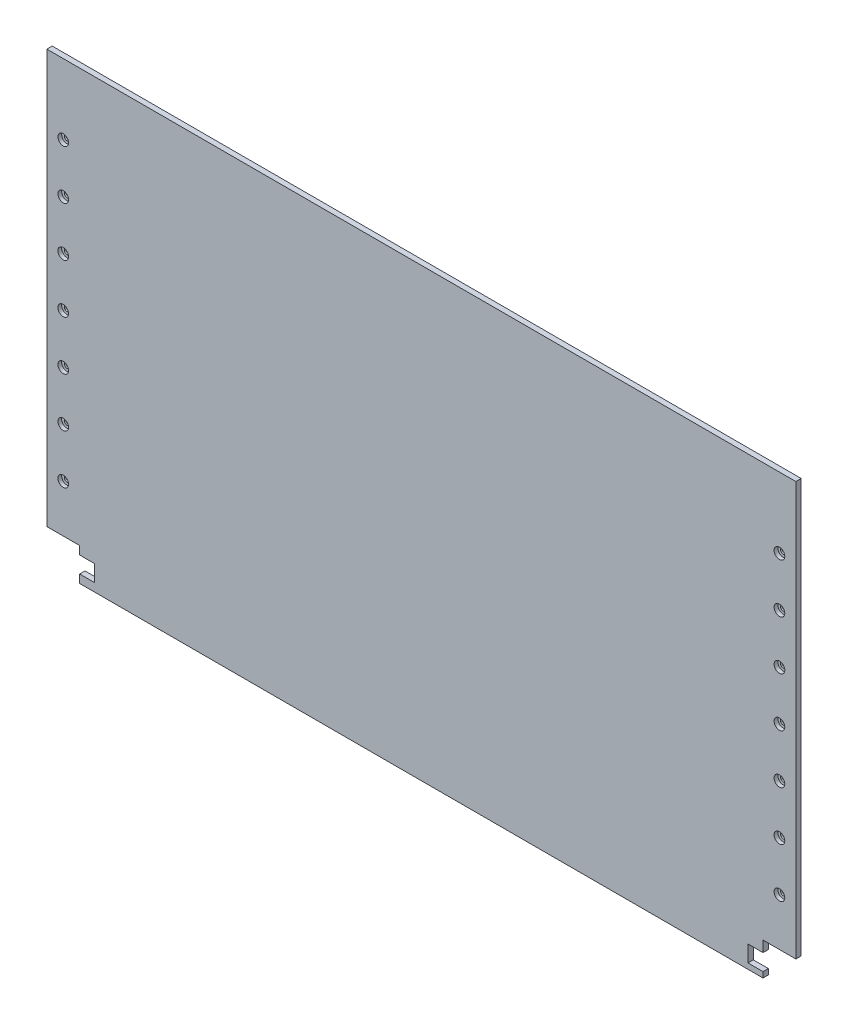
from build123d import *

# Parameters (mm, degrees)
BOSS_EXTRU_1_DEPTH         = 6.5
D_GAGEMENT_M61_D           = 6.6
R_P_TITION_LIN_AIRE1_COUNT = 7
R_P_TITION_LIN_AIRE1_PITCH = 60


with BuildPart() as part:
    # Esquisse1 → Boss.-Extru.1 (new body)
    with BuildSketch(Plane.XY):
        Polygon((416, -265.000000009), (416, -251.75), (456, -251.75), (456, 251.75), (-456, 251.75), (-456, -251.75), (-416, -251.75), (-416, -261.75000001), (-397.670089581, -261.75000001), (-397.670089581, -281.75000001), (-416, -281.75000001), (-416, -291.75), (416, -291.75), (416, -288.5), (416, -285.000000009), (397.67, -285.000000009), (397.67, -265.000000009), align=None)
    extrude(amount=BOSS_EXTRU_1_DEPTH)

    # Dégagement M61 (through all)
    with Locations(Plane(origin=(0, 0, 0), x_dir=(-1, 0, 0), z_dir=(0, 0, -1))):
        with Locations((436.025271582, 166.031516539)):
            Hole(D_GAGEMENT_M61_D / 2)

    # Esquisse5 → Chambrage pour vis à tête ronde bombée M61 (revolve, cut)
    with BuildSketch(Plane(origin=(-436.025271582, 166.031516539, 6.5), x_dir=(0, -1, 0), z_dir=(1, 0, 0))):
        Polygon((0, 0), (0, 6.5), (3.3, 6.5), (3.3, 4.625), (3.325, 4.6), (6.5, 4.6), (6.5, 0), align=None)
    chambrage_pour_vis_t_te_ronde_bomb_e_m = revolve(axis=Axis((-436.025271582, 166.031516539, 12.85), (0, 0, -1)), mode=Mode.SUBTRACT)

    # Répétition linéaire1: Chambrage pour vis à tête ronde bombée M61 ×7
    with Locations(*[(0, -i * R_P_TITION_LIN_AIRE1_PITCH, 0) for i in range(1, R_P_TITION_LIN_AIRE1_COUNT)]):
        add(chambrage_pour_vis_t_te_ronde_bomb_e_m, mode=Mode.SUBTRACT)

    # Symétrie2 copy 1 sketch → Symétrie2 copy 1 (revolve, cut)
    with BuildSketch(Plane(origin=(436.025271582, 106.031516539, 6.5), x_dir=(0, -1, 0), z_dir=(-1, 0, 0))):
        Polygon((0, 0), (0, -6.5), (3.3, -6.5), (3.3, -4.625), (3.325, -4.6), (6.5, -4.6), (6.5, 0), align=None)
    revolve(axis=Axis((436.025271582, 106.031516539, 12.85), (0, 0, 1)), mode=Mode.SUBTRACT)

    # Symétrie2 copy 2 sketch → Symétrie2 copy 2 (revolve, cut)
    with BuildSketch(Plane(origin=(436.025271582, 46.031516539, 6.5), x_dir=(0, -1, 0), z_dir=(-1, 0, 0))):
        Polygon((0, 0), (0, -6.5), (3.3, -6.5), (3.3, -4.625), (3.325, -4.6), (6.5, -4.6), (6.5, 0), align=None)
    revolve(axis=Axis((436.025271582, 46.031516539, 12.85), (0, 0, 1)), mode=Mode.SUBTRACT)

    # Symétrie2 copy 3 sketch → Symétrie2 copy 3 (revolve, cut)
    with BuildSketch(Plane(origin=(436.025271582, -13.968483461, 6.5), x_dir=(0, -1, 0), z_dir=(-1, 0, 0))):
        Polygon((0, 0), (0, -6.5), (3.3, -6.5), (3.3, -4.625), (3.325, -4.6), (6.5, -4.6), (6.5, 0), align=None)
    revolve(axis=Axis((436.025271582, -13.968483461, 12.85), (0, 0, 1)), mode=Mode.SUBTRACT)

    # Symétrie2 copy 4 sketch → Symétrie2 copy 4 (revolve, cut)
    with BuildSketch(Plane(origin=(436.025271582, -73.968483461, 6.5), x_dir=(0, -1, 0), z_dir=(-1, 0, 0))):
        Polygon((0, 0), (0, -6.5), (3.3, -6.5), (3.3, -4.625), (3.325, -4.6), (6.5, -4.6), (6.5, 0), align=None)
    revolve(axis=Axis((436.025271582, -73.968483461, 12.85), (0, 0, 1)), mode=Mode.SUBTRACT)

    # Symétrie2 copy 5 sketch → Symétrie2 copy 5 (revolve, cut)
    with BuildSketch(Plane(origin=(436.025271582, -133.968483461, 6.5), x_dir=(0, -1, 0), z_dir=(-1, 0, 0))):
        Polygon((0, 0), (0, -6.5), (3.3, -6.5), (3.3, -4.625), (3.325, -4.6), (6.5, -4.6), (6.5, 0), align=None)
    revolve(axis=Axis((436.025271582, -133.968483461, 12.85), (0, 0, 1)), mode=Mode.SUBTRACT)

    # Symétrie2 copy 6 sketch → Symétrie2 copy 6 (revolve, cut)
    with BuildSketch(Plane(origin=(436.025271582, -193.968483461, 6.5), x_dir=(0, -1, 0), z_dir=(-1, 0, 0))):
        Polygon((0, 0), (0, -6.5), (3.3, -6.5), (3.3, -4.625), (3.325, -4.6), (6.5, -4.6), (6.5, 0), align=None)
    revolve(axis=Axis((436.025271582, -193.968483461, 12.85), (0, 0, 1)), mode=Mode.SUBTRACT)

    # Symétrie2 copy 7 sketch → Symétrie2 copy 7 (revolve, cut)
    with BuildSketch(Plane(origin=(436.025271582, 166.031516539, 6.5), x_dir=(0, -1, 0), z_dir=(-1, 0, 0))):
        Polygon((0, 0), (0, -6.5), (3.3, -6.5), (3.3, -4.625), (3.325, -4.6), (6.5, -4.6), (6.5, 0), align=None)
    revolve(axis=Axis((436.025271582, 166.031516539, 12.85), (0, 0, 1)), mode=Mode.SUBTRACT)


solid = part.part
